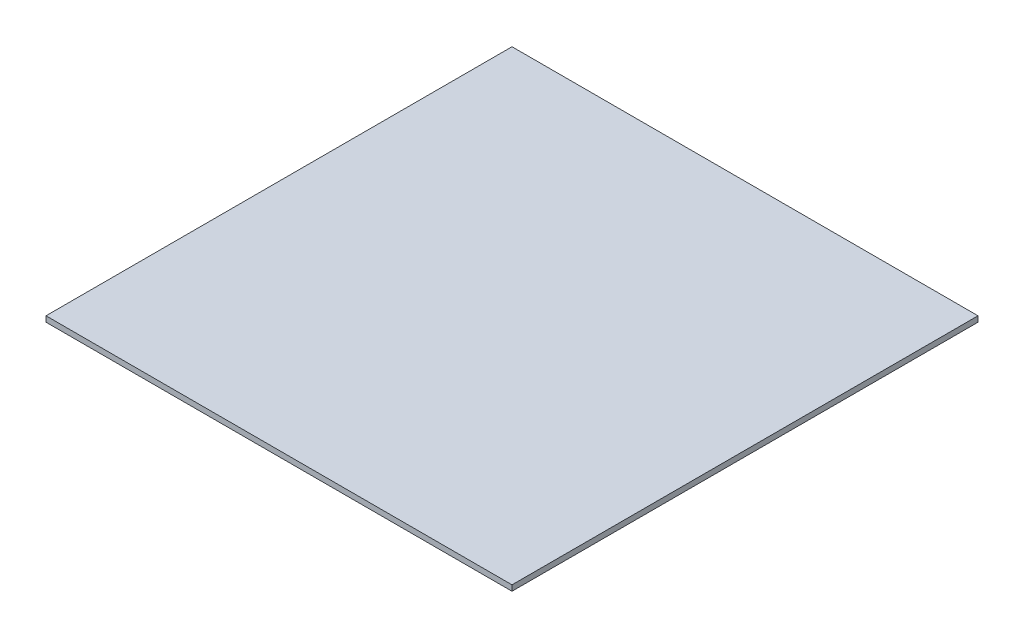
from build123d import *

# Parameters (mm, degrees)
SKETCH1_W           = 250
SKETCH1_H           = 250
BOSS_EXTRUDE1_DEPTH = 3


with BuildPart() as part:
    # Sketch1 → Boss-Extrude1 (new body)
    with BuildSketch(Plane(origin=(0, 0, 0), x_dir=(1, 0, 0), z_dir=(0, 1, 0))):
        Rectangle(SKETCH1_W, SKETCH1_H)
    extrude(amount=BOSS_EXTRUDE1_DEPTH)


solid = part.part
